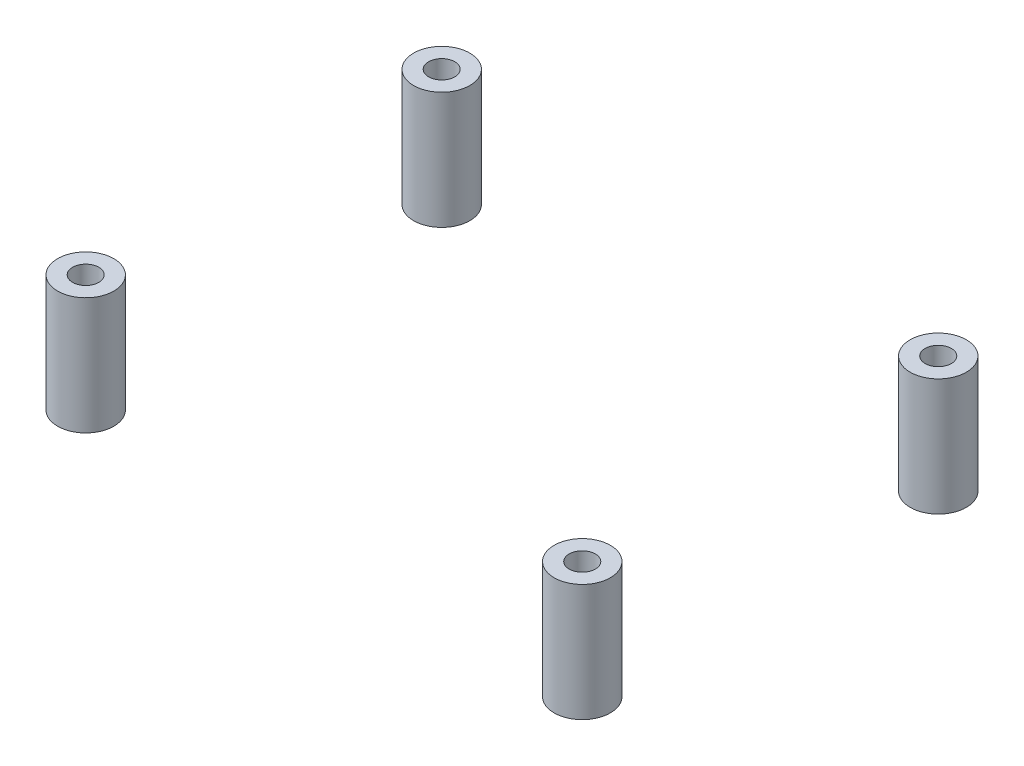
from build123d import *

# Parameters (mm, degrees)
SKETCH1_R             = 3
BOSS_EXTRUDE1_DEPTH   = 12.5
BOSS_EXTRUDE1_2_DEPTH = 12.5
BOSS_EXTRUDE1_3_DEPTH = 12.5
BOSS_EXTRUDE1_4_DEPTH = 12.5
SKETCH2_R             = 1.4
CUT_EXTRUDE1_DEPTH    = 10


with BuildPart() as part:
    # Sketch1 → Boss-Extrude1 (new body)
    with BuildSketch(Plane(origin=(0, 0, 0), x_dir=(1, 0, 0), z_dir=(0, 1, 0))):
        with Locations(Location((-34.235262899, 23.928667677, 0), (0, 0, 270))):
            Circle(SKETCH1_R)
    extrude(amount=BOSS_EXTRUDE1_DEPTH)


with BuildPart() as body_2:
    # Sketch1 → Boss-Extrude1 2 (new body)
    with BuildSketch(Plane(origin=(0, 0, 0), x_dir=(1, 0, 0), z_dir=(0, 1, 0))):
        with Locations(Location((-34.235262899, -14.071332323, 0), (0, 0, 270))):
            Circle(SKETCH1_R)
    extrude(amount=BOSS_EXTRUDE1_2_DEPTH)


with BuildPart() as body_3:
    # Sketch1 → Boss-Extrude1 3 (new body)
    with BuildSketch(Plane(origin=(0, 0, 0), x_dir=(1, 0, 0), z_dir=(0, 1, 0))):
        with Locations(Location((18.764737101, -14.071332323, 0), (0, 0, 270))):
            Circle(SKETCH1_R)
    extrude(amount=BOSS_EXTRUDE1_3_DEPTH)


with BuildPart() as body_4:
    # Sketch1 → Boss-Extrude1 4 (new body)
    with BuildSketch(Plane(origin=(0, 0, 0), x_dir=(1, 0, 0), z_dir=(0, 1, 0))):
        with Locations(Location((18.764737101, 23.928667677, 0), (0, 0, 270))):
            Circle(SKETCH1_R)
    extrude(amount=BOSS_EXTRUDE1_4_DEPTH)


with BuildPart() as cut_extrude1_tool:
    # Sketch2 → Cut-Extrude1 (new body)
    with BuildSketch(Plane(origin=(0, 12.5, 0), x_dir=(1, 0, 0), z_dir=(0, 1, 0))):
        with Locations(Location((-34.235262899, 23.928667677, 0), (0, 0, 270))):
            Circle(SKETCH2_R)
        with Locations(Location((18.764737101, 23.928667677, 0), (0, 0, 270))):
            Circle(SKETCH2_R)
        with Locations(Location((18.764737101, -14.071332323, 0), (0, 0, 270))):
            Circle(SKETCH2_R)
        with Locations(Location((-34.235262899, -14.071332323, 0), (0, 0, 270))):
            Circle(SKETCH2_R)
    extrude(amount=-CUT_EXTRUDE1_DEPTH)


with BuildPart() as part_1:
    add(part.part)

    # Cut-Extrude1: cut by cut_extrude1_tool
    add(cut_extrude1_tool.part, mode=Mode.SUBTRACT)


with BuildPart() as body_2_1:
    add(body_2.part)

    # Cut-Extrude1: cut by cut_extrude1_tool
    add(cut_extrude1_tool.part, mode=Mode.SUBTRACT)


with BuildPart() as body_3_1:
    add(body_3.part)

    # Cut-Extrude1: cut by cut_extrude1_tool
    add(cut_extrude1_tool.part, mode=Mode.SUBTRACT)


with BuildPart() as body_4_1:
    add(body_4.part)

    # Cut-Extrude1: cut by cut_extrude1_tool
    add(cut_extrude1_tool.part, mode=Mode.SUBTRACT)


solid = Compound([part_1.part, body_2_1.part, body_3_1.part, body_4_1.part])
